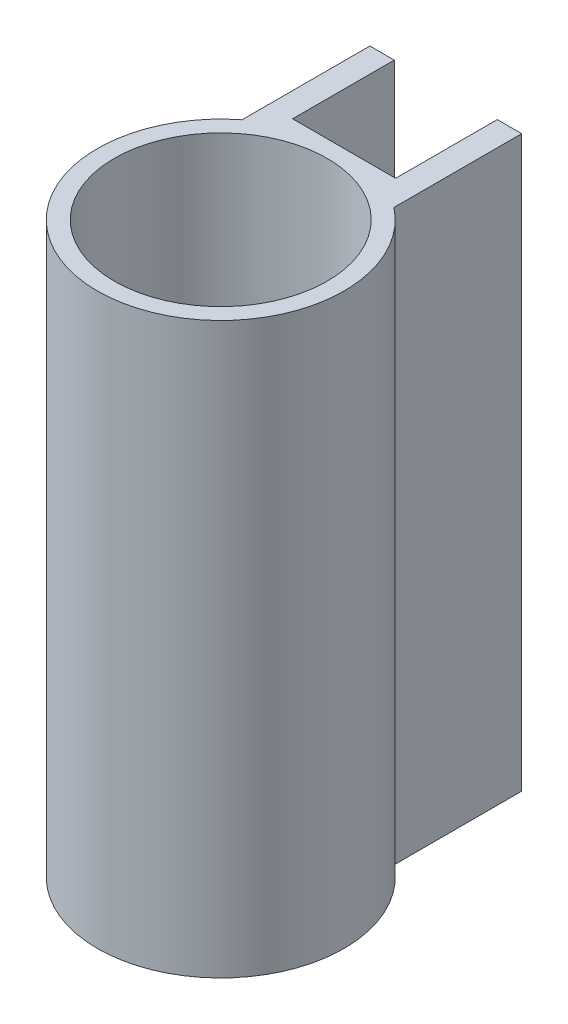
from build123d import *

# Parameters (mm, degrees)
SKETCH1_R                       = 23.114
SKETCH1_R_2                     = 9.652
BOSS_EXTRUDE1_DEPTH             = 5.08
SKETCH2_R                       = 19.939
BOSS_EXTRUDE2_DEPTH             = 101.6
BOSS_EXTRUDE2_DIRECTION_2_REACH = 35.081


with BuildPart() as part:
    # Sketch1 → Boss-Extrude1 (new body)
    with BuildSketch(Plane(origin=(0, 0, 0), x_dir=(1, 0, 0), z_dir=(0, 1, 0))):
        with Locations(Location((0, 0, 0), (0, 0, 270))):
            Circle(SKETCH1_R)
        with Locations(Location((0, 0, 0), (0, 0, 270))):
            Circle(SKETCH1_R_2, mode=Mode.SUBTRACT)
    extrude(amount=BOSS_EXTRUDE1_DEPTH)

    # Sketch2 → Boss-Extrude2 (add)
    with BuildSketch(Plane(origin=(0, 5.08, 0), x_dir=(1, 0, 0), z_dir=(0, 1, 0))):
        with BuildLine():
            Line((-14.224, 18.219078462), (-14.224, 42.164))
            Line((-14.224, 42.164), (-9.652, 42.164))
            Line((-9.652, 42.164), (-9.652, 23.114))
            Line((-9.652, 23.114), (9.652, 23.114))
            Line((9.652, 23.114), (9.652, 42.164))
            Line((9.652, 42.164), (14.224, 42.164))
            Line((14.224, 42.164), (14.224, 18.219078462))
            ThreePointArc((14.224, 18.219078462), (0, -23.114), (-14.224, 18.219078462))
        make_face()
        with Locations(Location((0, 0, 0), (0, 0, 270))):
            Circle(SKETCH2_R, mode=Mode.SUBTRACT)
    extrude(amount=BOSS_EXTRUDE2_DEPTH)

    # Boss-Extrude2 direction 2: up to this face of the body (flat: up to its plane)
    boss_extrude2_direction_2_end = Plane(part.part.faces().sort_by_distance((0, 0, -22.460237354))[0])
    # Sketch2 → Boss-Extrude2 direction 2 (add, up to the picked face)
    with BuildSketch(Plane(origin=(0, 5.08, 0), x_dir=(1, 0, 0), z_dir=(0, 1, 0)), mode=Mode.PRIVATE) as boss_extrude2_direction_2_sk1:
        with BuildLine():
            Line((-14.224, 18.219078462), (-14.224, 42.164))
            Line((-14.224, 42.164), (-9.652, 42.164))
            Line((-9.652, 42.164), (-9.652, 23.114))
            Line((-9.652, 23.114), (9.652, 23.114))
            Line((9.652, 23.114), (9.652, 42.164))
            Line((9.652, 42.164), (14.224, 42.164))
            Line((14.224, 42.164), (14.224, 18.219078462))
            ThreePointArc((14.224, 18.219078462), (0, -23.114), (-14.224, 18.219078462))
        make_face()
        with Locations(Location((0, 0, 0), (0, 0, 270))):
            Circle(SKETCH2_R, mode=Mode.SUBTRACT)
    boss_extrude2_direction_2_tool1 = split(extrude(boss_extrude2_direction_2_sk1.sketch, amount=-BOSS_EXTRUDE2_DIRECTION_2_REACH, mode=Mode.PRIVATE), bisect_by=boss_extrude2_direction_2_end, keep=Keep.BOTH, mode=Mode.PRIVATE)
    add(boss_extrude2_direction_2_tool1.solids().sort_by(Axis((-13.42411, 5.08, -30.191539), (0, -1, 0)))[0])


solid = part.part
